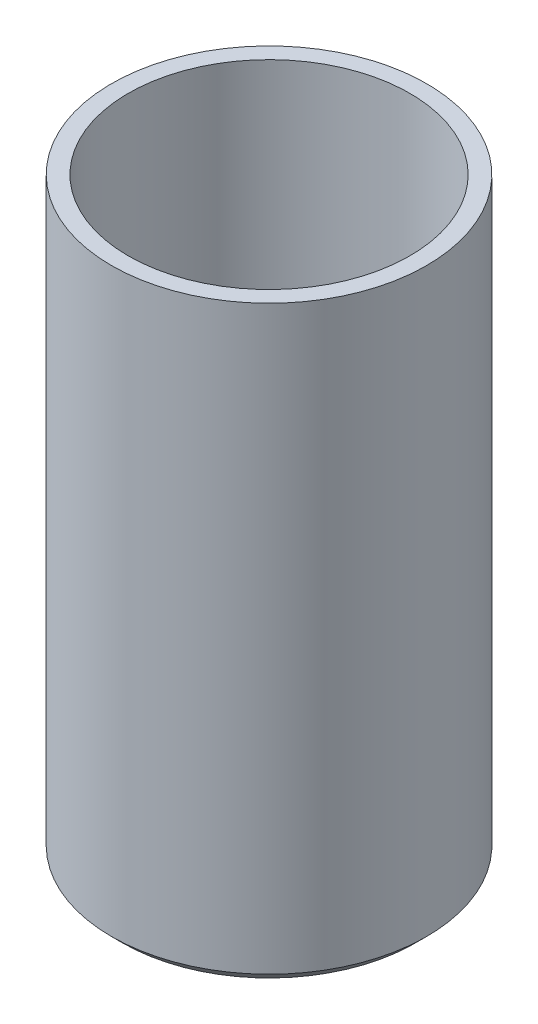
from build123d import *

# Parameters (mm, degrees)
SKETCH1_R           = 14.1
BOSS_EXTRUDE1_DEPTH = 3
SKETCH2_R           = 14.1
SKETCH2_R_2         = 12.6
BOSS_EXTRUDE2_DEPTH = 50
CHAMFER1_SIZE       = 1


with BuildPart() as part:
    # Sketch1 → Boss-Extrude1 (new body)
    with BuildSketch(Plane(origin=(0, 0, 0), x_dir=(1, 0, 0), z_dir=(0, 1, 0))):
        with Locations(Location((0, 0, 0), (0, 0, 270))):
            Circle(SKETCH1_R)
    extrude(amount=BOSS_EXTRUDE1_DEPTH)

    # Sketch2 → Boss-Extrude2 (add)
    with BuildSketch(Plane(origin=(0, 3, 0), x_dir=(1, 0, 0), z_dir=(0, 1, 0))):
        with Locations(Location((0, 0, 0), (0, 0, 270))):
            Circle(SKETCH2_R)
        with Locations(Location((0, 0, 0), (0, 0, 270))):
            Circle(SKETCH2_R_2, mode=Mode.SUBTRACT)
    extrude(amount=BOSS_EXTRUDE2_DEPTH)

    # Chamfer1
    chamfer1_edges = [part.edges().sort_by_distance(p)[0] for p in [
        (0, 0, -14.1),
    ]]
    chamfer(chamfer1_edges, length=CHAMFER1_SIZE)


solid = part.part
